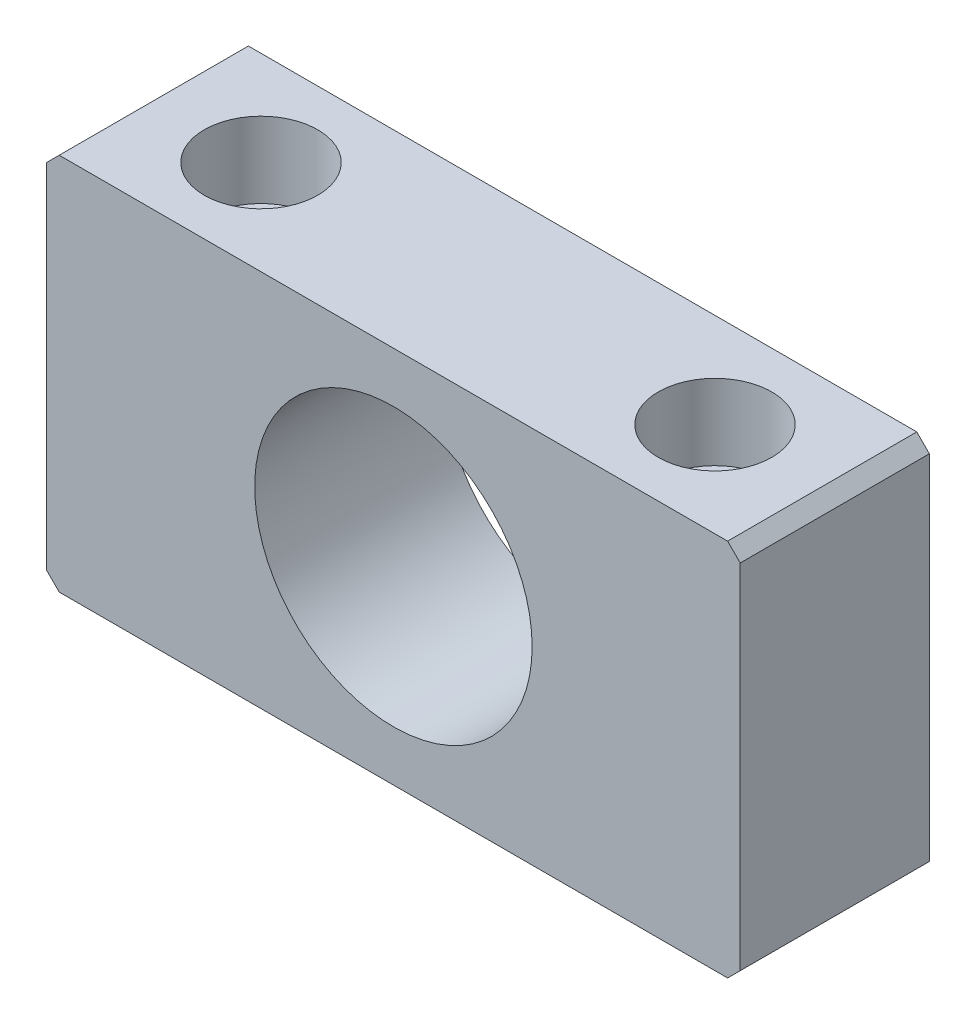
from build123d import *

# Parameters (mm, degrees)
SKETCH_1_W          = 55
SKETCH_1_H          = 30
SKETCH_1_R          = 11
EXTRUDE_1_DEPTH     = 15
SKETCH_2_R          = 2.55
CUT_EXTRUDE_1_DEPTH = 44.373378932
SKETCH_3_R          = 4.5
CUT_EXTRUDE_2_DEPTH = 6
CHAMFER_1_SIZE      = 1


with BuildPart() as part:
    # 草图1 → 凸台-拉伸1 (new body)
    with BuildSketch(Plane.XY):
        Rectangle(SKETCH_1_W, SKETCH_1_H)
        Circle(SKETCH_1_R, mode=Mode.SUBTRACT)
    extrude(amount=EXTRUDE_1_DEPTH)

    # 草图2 → 切除-拉伸1 (cut, through all)
    with BuildSketch(Plane(origin=(0, 15, 0), x_dir=(1, 0, 0), z_dir=(0, 1, 0))):
        with Locations(Location((-18, -7.5, 0), (0, 0, 270))):
            Circle(SKETCH_2_R)
        with Locations(Location((18, -7.5, 0), (0, 0, 90))):
            Circle(SKETCH_2_R)
    extrude(amount=-CUT_EXTRUDE_1_DEPTH, mode=Mode.SUBTRACT)

    # 草图3 → 切除-拉伸2 (cut)
    with BuildSketch(Plane(origin=(0, 15, 0), x_dir=(1, 0, 0), z_dir=(0, 1, 0))):
        with Locations(Location((-18, -7.5, 0), (0, 0, 270))):
            Circle(SKETCH_3_R)
        with Locations(Location((18, -7.5, 0), (0, 0, 270))):
            Circle(SKETCH_3_R)
    extrude(amount=-CUT_EXTRUDE_2_DEPTH, mode=Mode.SUBTRACT)

    # 倒角1
    chamfer_1_edges = [part.edges().sort_by_distance(p)[0] for p in [
        (-27.5, 15, 7.5),
        (27.5, 15, 7.5),
        (27.5, -15, 7.5),
        (-27.5, -15, 7.5),
    ]]
    chamfer(chamfer_1_edges, length=CHAMFER_1_SIZE)


solid = part.part
